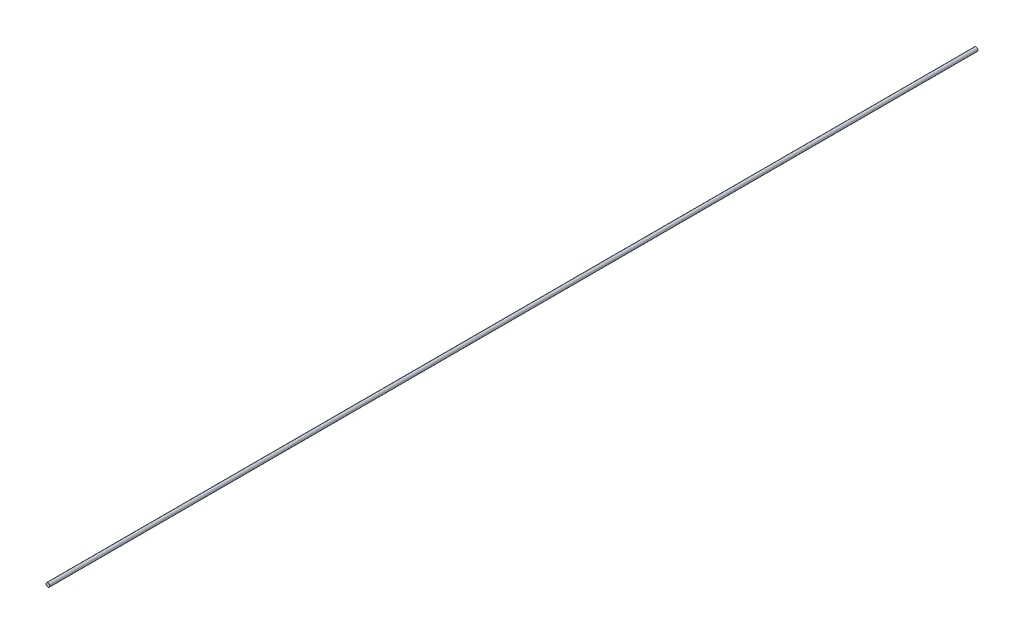
from build123d import *

# Parameters (mm, degrees)
SKETCH1_R           = 1.905
BOSS_EXTRUDE1_DEPTH = 914.4


with BuildPart() as part:
    # Sketch1 → Boss-Extrude1 (new body)
    with BuildSketch(Plane.XY):
        Circle(SKETCH1_R)
    extrude(amount=BOSS_EXTRUDE1_DEPTH)


solid = part.part
